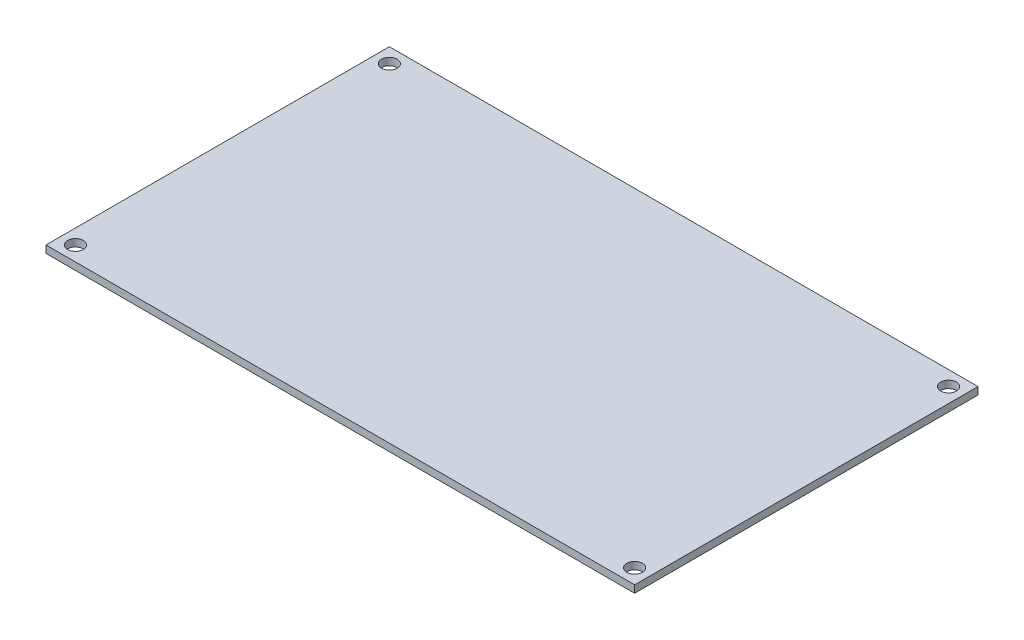
from build123d import *

# Parameters (mm, degrees)
SKETCH_1_W          = 120
SKETCH_1_H          = 70
EXTRUDE_1_DEPTH     = 1.5
SKETCH_2_R          = 1.6
CUT_EXTRUDE_1_DEPTH = 1.5


with BuildPart() as part:
    # Эскиз1 → Бобышка-Вытянуть1 (new body)
    with BuildSketch(Plane(origin=(0, 0, 0), x_dir=(1, 0, 0), z_dir=(0, 1, 0))):
        Rectangle(SKETCH_1_W, SKETCH_1_H)
    extrude(amount=EXTRUDE_1_DEPTH)

    # Эскиз2 → Вырез-Вытянуть1 (cut)
    with BuildSketch(Plane(origin=(0, 1.5, 0), x_dir=(1, 0, 0), z_dir=(0, 1, 0))):
        with Locations(Location((-57, 32, 0), (0, 0, 270))):
            Circle(SKETCH_2_R)
        with Locations(Location((57, -32, 0), (0, 0, 270))):
            Circle(SKETCH_2_R)
        with Locations(Location((57, 32, 0), (0, 0, 270))):
            Circle(SKETCH_2_R)
        with Locations(Location((-57, -32, 0), (0, 0, 270))):
            Circle(SKETCH_2_R)
    extrude(amount=-CUT_EXTRUDE_1_DEPTH, mode=Mode.SUBTRACT)


solid = part.part
